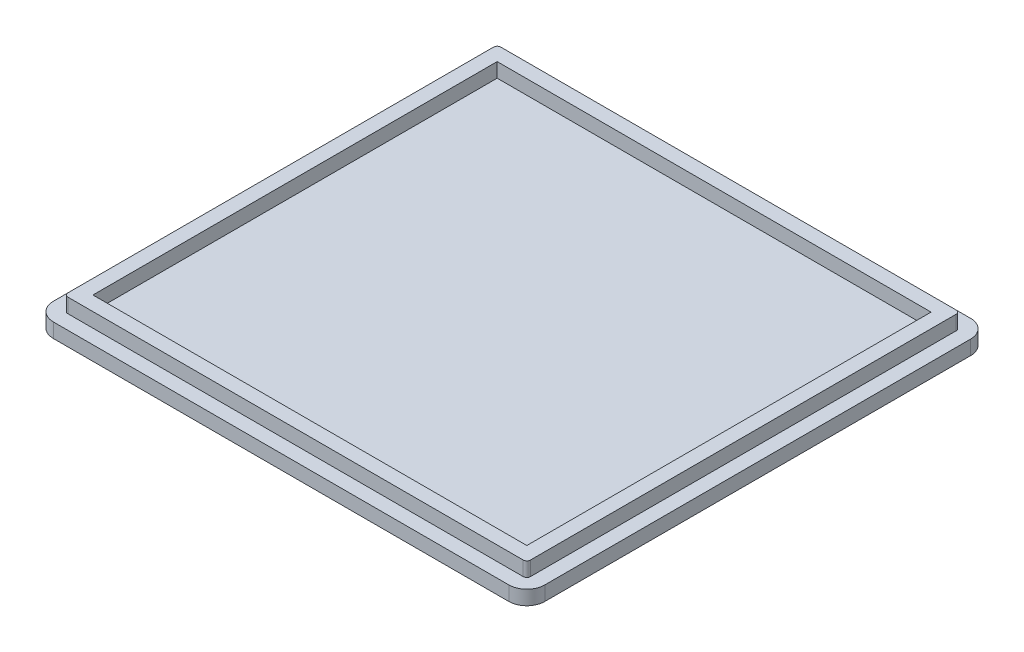
from build123d import *

# Parameters (mm, degrees)
SKETCH1_W           = 54.7
SKETCH1_H           = 51.4
BOSS_EXTRUDE1_DEPTH = 1.6
SKETCH1_3_W         = 51.5
SKETCH1_3_H         = 48.2
SKETCH1_3_W_2       = 48.3
SKETCH1_3_H_2       = 45
BOSS_EXTRUDE2_DEPTH = 3.2
FILLET1_R           = 2
FILLET2_R           = 0.4


with BuildPart() as part:
    # Sketch1 → Boss-Extrude1 (new body)
    with BuildSketch(Plane(origin=(0, 0, 0), x_dir=(1, 0, 0), z_dir=(0, 1, 0))):
        Rectangle(SKETCH1_W, SKETCH1_H)
    extrude(amount=BOSS_EXTRUDE1_DEPTH)

    # Sketch1<3> → Boss-Extrude2 (add)
    with BuildSketch(Plane(origin=(0, 0, 0), x_dir=(1, 0, 0), z_dir=(0, 1, 0))):
        Rectangle(SKETCH1_3_W, SKETCH1_3_H)
        Rectangle(SKETCH1_3_W_2, SKETCH1_3_H_2, mode=Mode.SUBTRACT)
    extrude(amount=BOSS_EXTRUDE2_DEPTH)

    # Fillet1
    fillet1_edges = [part.edges().sort_by_distance(p)[0] for p in [
        (-27.35, 0.8, 25.7),
        (27.35, 0.8, 25.7),
        (-27.35, 0.8, -25.7),
        (27.35, 0.8, -25.7),
    ]]
    fillet(fillet1_edges, radius=FILLET1_R)

    # Fillet2
    fillet2_edges = [part.edges().sort_by_distance(p)[0] for p in [
        (25.75, 2.4, -24.1),
        (25.75, 2.4, 24.1),
        (-25.75, 2.4, 24.1),
        (-25.75, 2.4, -24.1),
    ]]
    fillet(fillet2_edges, radius=FILLET2_R)


solid = part.part
